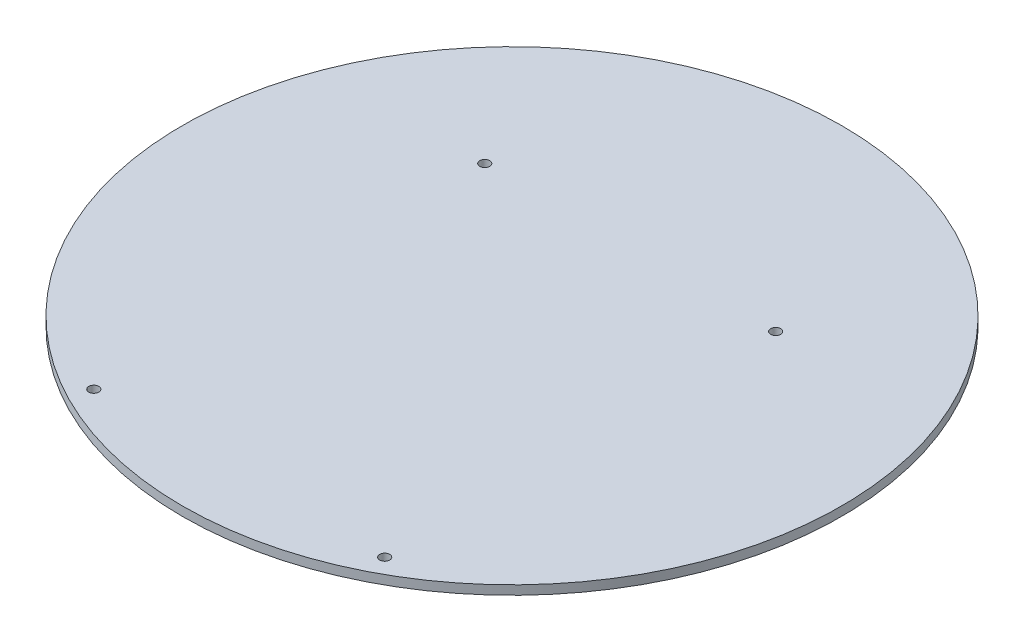
from build123d import *

# Parameters (mm, degrees)
SKETCH_2_R               = 72.5
EXTRUDE_1_DEPTH          = 2
CUT_EXTRUDE_1_DEPTH      = 103.549987811
CUT_EXTRUDE_1_DEPTH_BACK = 103.549987811
SKETCH_3_R               = 1.1


with BuildPart() as part:
    # 草图2 → 凸台-拉伸1 (new body)
    with BuildSketch(Plane(origin=(0, 0, 0), x_dir=(1, 0, 0), z_dir=(0, 1, 0))):
        with Locations(Location((0, 0, 0), (0, 0, 270))):
            Circle(SKETCH_2_R)
    extrude(amount=EXTRUDE_1_DEPTH)

    # 草图3 → 切除-拉伸1 (cut, two sides: drawn at the far end of the back side and taken through both)
    with BuildSketch(Plane.XZ.offset(-CUT_EXTRUDE_1_DEPTH_BACK)):
        with Locations(Location((32, 60, 0), (0, 0, 270))):
            Circle(SKETCH_3_R)
        with Locations(Location((-32, 60, 0), (0, 0, 270))):
            Circle(SKETCH_3_R)
        with Locations(Location((-32, -26, 0), (0, 0, 270))):
            Circle(SKETCH_3_R)
        with Locations(Location((32, -26, 0), (0, 0, 270))):
            Circle(SKETCH_3_R)
    extrude(amount=CUT_EXTRUDE_1_DEPTH + CUT_EXTRUDE_1_DEPTH_BACK, mode=Mode.SUBTRACT)


solid = part.part
